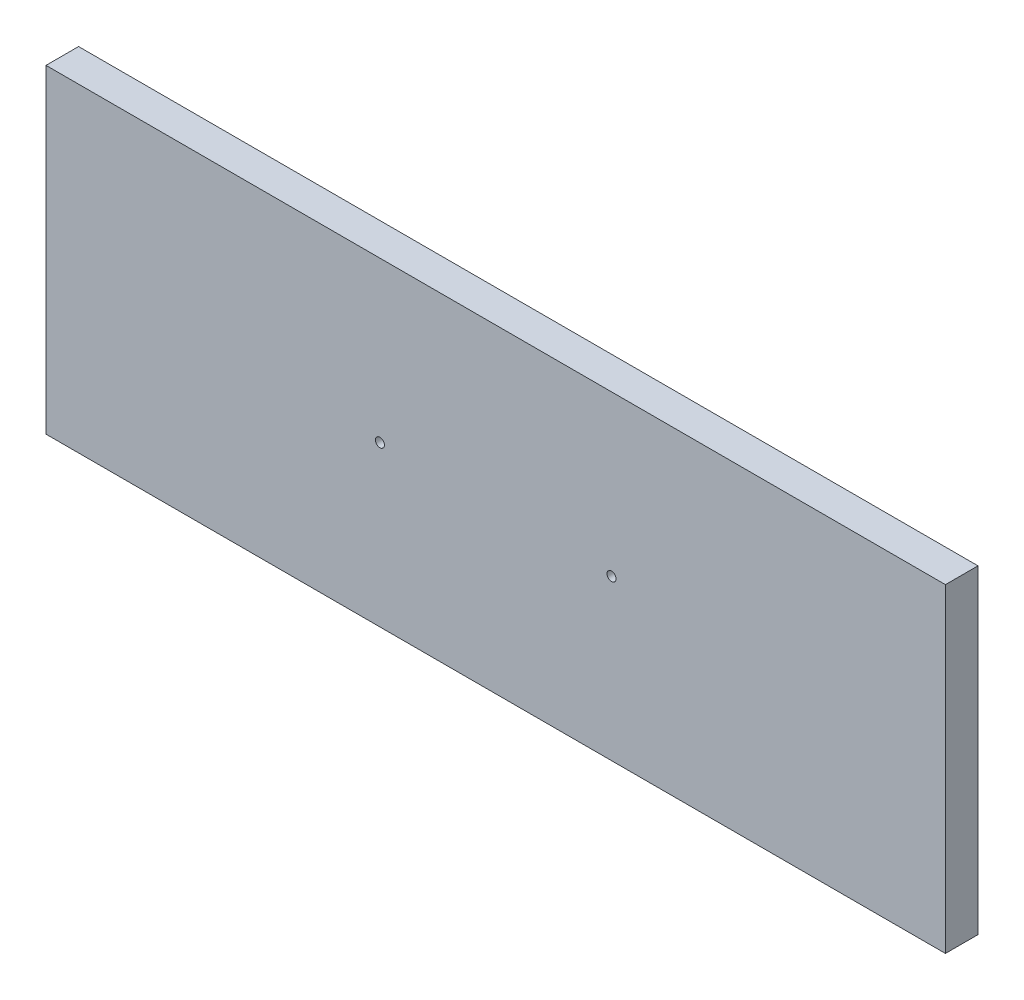
from build123d import *

# Parameters (mm, degrees)
SKETCH1_W           = 497
SKETCH1_H           = 176.5
SKETCH1_R           = 2.5
BOSS_EXTRUDE1_DEPTH = 18
SKETCH2_R           = 5
CUT_EXTRUDE1_DEPTH  = 13


with BuildPart() as part:
    # Sketch1 → Boss-Extrude1 (new body)
    with BuildSketch(Plane.XY):
        with Locations((0, -482.25)):
            Rectangle(SKETCH1_W, SKETCH1_H)
        with Locations((64, -482.25)):
            Circle(SKETCH1_R, mode=Mode.SUBTRACT)
        with Locations((-64, -482.25)):
            Circle(SKETCH1_R, mode=Mode.SUBTRACT)
    extrude(amount=BOSS_EXTRUDE1_DEPTH)

    # Sketch2 → Cut-Extrude1 (cut)
    with BuildSketch(Plane(origin=(0, 0, 0), x_dir=(-1, 0, 0), z_dir=(0, 0, -1))):
        with Locations((224, -514)):
            Circle(SKETCH2_R)
        with Locations((-224, -514)):
            Circle(SKETCH2_R)
        with Locations((224, -450)):
            Circle(SKETCH2_R)
        with Locations((-224, -450)):
            Circle(SKETCH2_R)
    extrude(amount=-CUT_EXTRUDE1_DEPTH, mode=Mode.SUBTRACT)


solid = part.part
